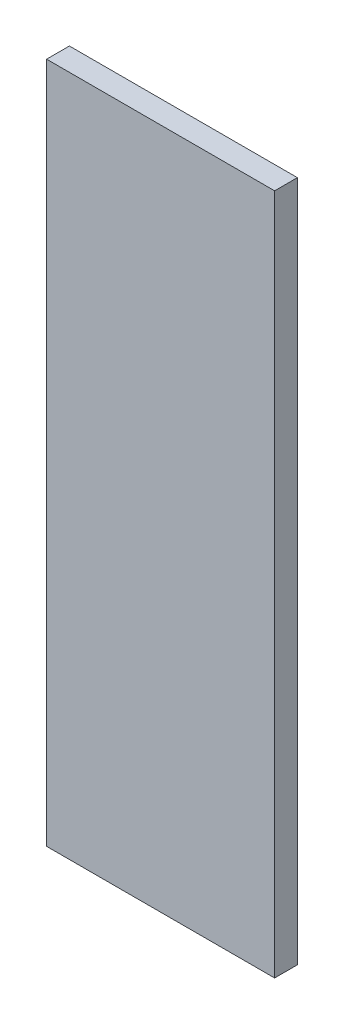
from build123d import *

# Parameters (mm, degrees)
SKETCH1_W           = 40
SKETCH1_H           = 119.6
BOSS_EXTRUDE1_DEPTH = 4


with BuildPart() as part:
    # Sketch1 → Boss-Extrude1 (new body)
    with BuildSketch(Plane.XY):
        Rectangle(SKETCH1_W, SKETCH1_H)
    extrude(amount=BOSS_EXTRUDE1_DEPTH)


solid = part.part
